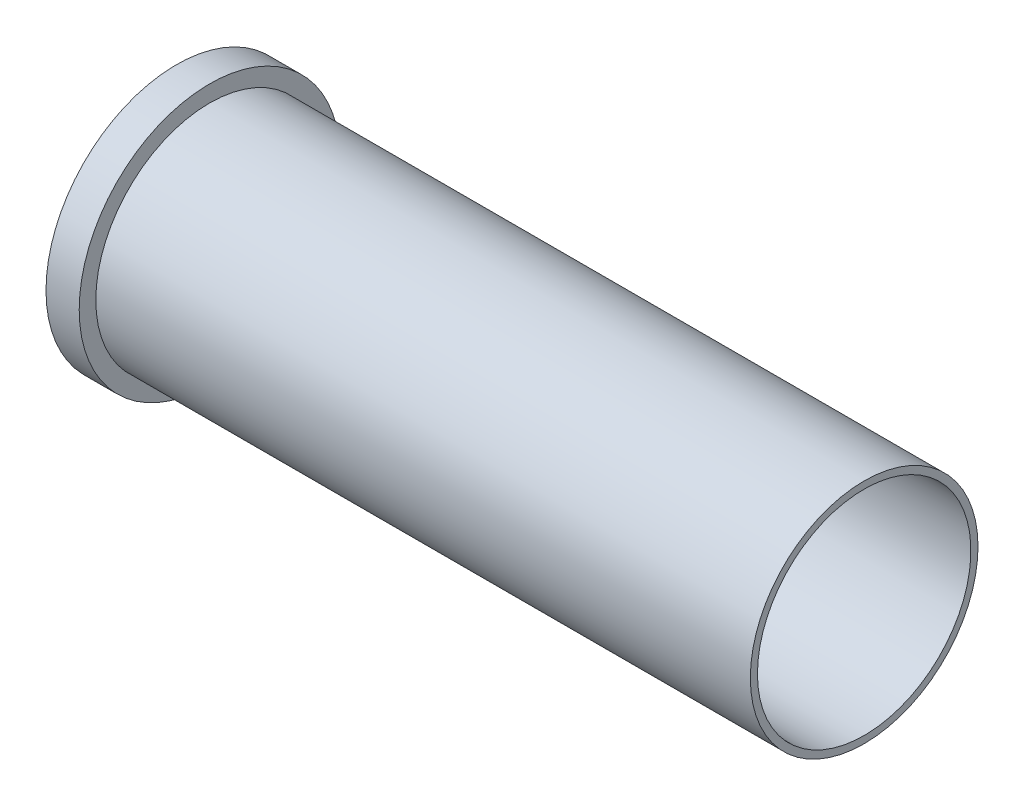
from build123d import *


with BuildPart() as part:
    # Esboço1 → Revolução1 (revolve)
    with BuildSketch(Plane(origin=(0, 0, 0), x_dir=(1, 0, 0), z_dir=(0, 1, 0)), mode=Mode.PRIVATE) as revolu_o1_sk:
        Polygon((3, 1.1), (3, 2.25), (0, 2.25), (0, 5.5), (1.4, 5.5), (1.4, 4.8), (29, 4.8), (29, 4.5), (3.8, 4.5), (3.8, 1.1), align=None)
    revolve(revolu_o1_sk.sketch.rotate(Axis((0, 0, 0), (1, 0, 0)), 180), axis=Axis((0, 0, 0), (1, 0, 0)))


solid = part.part
